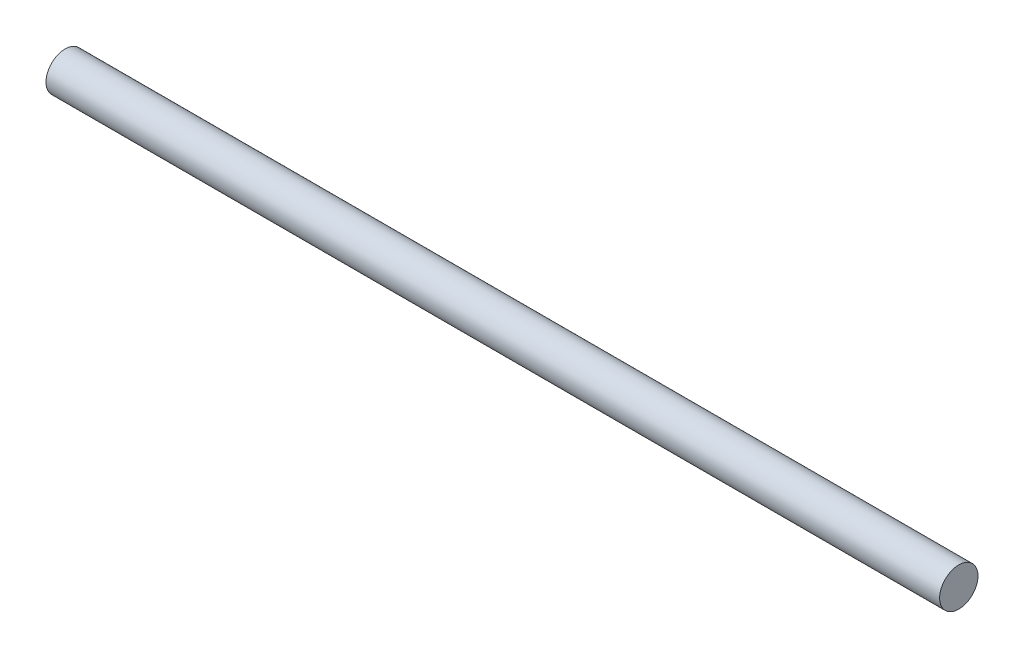
from build123d import *

# Parameters (mm, degrees)
SKETCH2_R          = 2.25
BASE_EXTRUDE_DEPTH = 104.775


with BuildPart() as part:
    # Sketch2 → Base-Extrude (new body)
    with BuildSketch(Plane(origin=(0, 0, 0), x_dir=(0, 0, -1), z_dir=(1, 0, 0))):
        Circle(SKETCH2_R)
    extrude(amount=BASE_EXTRUDE_DEPTH)


solid = part.part
